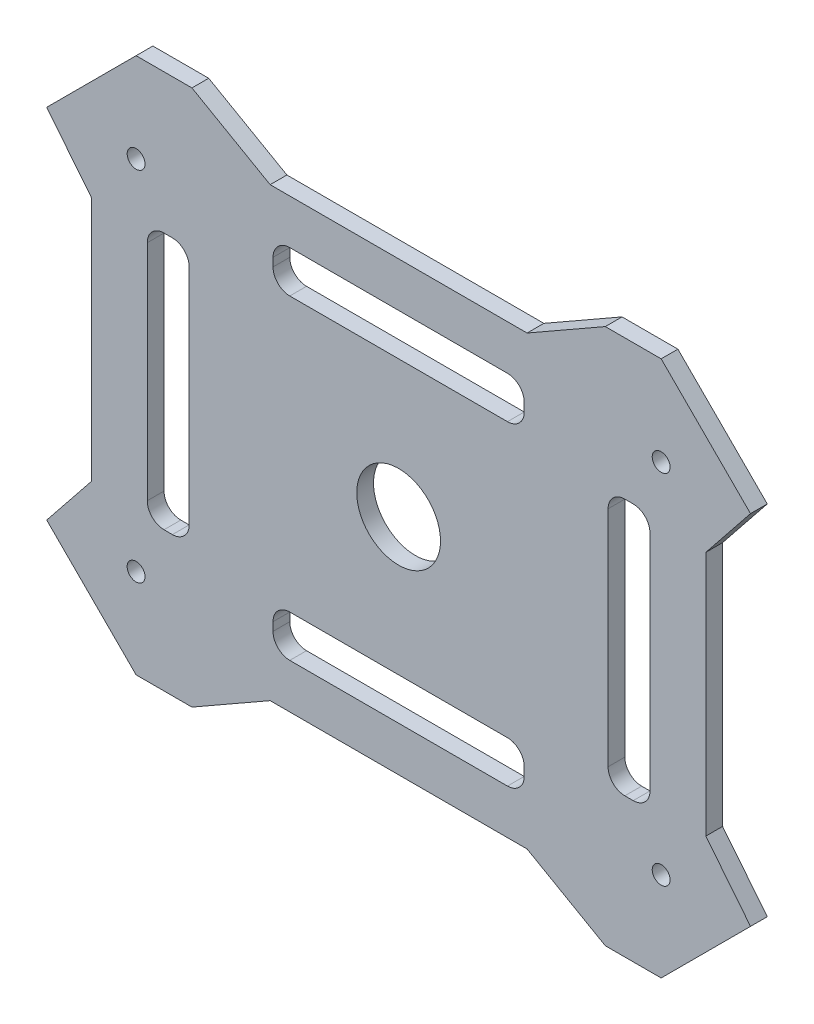
from build123d import *

# Parameters (mm, degrees)
SKETCH1_R           = 7.50000053
SKETCH1_R_2         = 1.6
BOSS_EXTRUDE1_DEPTH = 3


with BuildPart() as part:
    # Sketch1 → Boss-Extrude1 (new body)
    with BuildSketch(Plane.XY):
        Polygon((-135.687369551, 49.993029621), (-119.687369551, 65.993029621), (-109.687369551, 65.993029621), (-95.687369551, 57.993029621), (-49.687369551, 57.993029621), (-35.687369551, 65.993029621), (-25.687369551, 65.993029621), (-9.687369551, 49.993029621), (-17.687369551, 39.993029621), (-17.687369551, -4.006970379), (-9.687369551, -14.006970379), (-25.687369551, -30.006970379), (-35.687369551, -30.006970379), (-49.687369551, -22.006970379), (-95.687369551, -22.006970379), (-109.687369551, -30.006970379), (-119.687369551, -30.006970379), (-135.687369551, -14.006970379), (-127.687369551, -4.006970379), (-127.687369551, 39.993029621), align=None)
        with Locations((-72.687369551, 17.993029621)):
            Circle(SKETCH1_R, mode=Mode.SUBTRACT)
        with Locations((-119.687369551, 49.993029621)):
            Circle(SKETCH1_R_2, mode=Mode.SUBTRACT)
        with Locations((-25.687369551, 49.993029621)):
            Circle(SKETCH1_R_2, mode=Mode.SUBTRACT)
        with Locations((-25.687369551, -14.006970379)):
            Circle(SKETCH1_R_2, mode=Mode.SUBTRACT)
        with Locations((-119.687369551, -14.006970379)):
            Circle(SKETCH1_R_2, mode=Mode.SUBTRACT)
        with BuildLine():
            Line((-114.687369339, 40.993029833), (-113.187369339, 40.993029833))
            ThreePointArc((-113.187369339, 40.993029833), (-111.066048846, 40.114350115), (-110.187369127, 37.993029621))
            Line((-110.187369127, 37.993029621), (-110.187369127, -2.006970379))
            ThreePointArc((-110.187369127, -2.006970379), (-111.066048783, -4.128290723), (-113.187369127, -5.006970379))
            Line((-113.187369127, -5.006970379), (-114.687369551, -5.006970379))
            ThreePointArc((-114.687369551, -5.006970379), (-116.808689895, -4.128290723), (-117.687369551, -2.006970379))
            Line((-117.687369551, -2.006970379), (-117.687369551, 37.993029621))
            ThreePointArc((-117.687369551, 37.993029621), (-116.808689833, 40.114350115), (-114.687369339, 40.993029833))
        make_face(mode=Mode.SUBTRACT)
        with BuildLine():
            Line((-53.200533124, -14.006970379), (-92.174205979, -14.006970379))
            ThreePointArc((-92.174205979, -14.006970379), (-94.295526323, -13.128290723), (-95.174205979, -11.006970379))
            Line((-95.174205979, -11.006970379), (-95.174205979, -9.506970273))
            ThreePointArc((-95.174205979, -9.506970273), (-94.295526323, -7.385649929), (-92.174205979, -6.506970273))
            Line((-92.174205979, -6.506970273), (-53.200533124, -6.506970273))
            ThreePointArc((-53.200533124, -6.506970273), (-51.07921278, -7.385649929), (-50.200533124, -9.506970273))
            Line((-50.200533124, -9.506970273), (-50.200533124, -11.006970379))
            ThreePointArc((-50.200533124, -11.006970379), (-51.07921278, -13.128290723), (-53.200533124, -14.006970379))
        make_face(mode=Mode.SUBTRACT)
        with BuildLine():
            Line((-32.187369764, 40.993029833), (-30.687369764, 40.993029833))
            ThreePointArc((-30.687369764, 40.993029833), (-28.56604927, 40.114350115), (-27.687369551, 37.993029621))
            Line((-27.687369551, 37.993029621), (-27.687369551, -2.006970379))
            ThreePointArc((-27.687369551, -2.006970379), (-28.566049208, -4.128290723), (-30.687369551, -5.006970379))
            Line((-30.687369551, -5.006970379), (-32.187369976, -5.006970379))
            ThreePointArc((-32.187369976, -5.006970379), (-34.308690319, -4.128290723), (-35.187369976, -2.006970379))
            Line((-35.187369976, -2.006970379), (-35.187369976, 37.993029621))
            ThreePointArc((-35.187369976, 37.993029621), (-34.308690257, 40.114350115), (-32.187369764, 40.993029833))
        make_face(mode=Mode.SUBTRACT)
        with BuildLine():
            Line((-53.200533124, 42.493029515), (-92.174205979, 42.493029515))
            ThreePointArc((-92.174205979, 42.493029515), (-94.295526323, 43.371709171), (-95.174205979, 45.493029515))
            Line((-95.174205979, 45.493029515), (-95.174205979, 46.993029621))
            ThreePointArc((-95.174205979, 46.993029621), (-94.295526323, 49.114349965), (-92.174205979, 49.993029621))
            Line((-92.174205979, 49.993029621), (-53.200533124, 49.993029621))
            ThreePointArc((-53.200533124, 49.993029621), (-51.07921278, 49.114349965), (-50.200533124, 46.993029621))
            Line((-50.200533124, 46.993029621), (-50.200533124, 45.493029515))
            ThreePointArc((-50.200533124, 45.493029515), (-51.07921278, 43.371709171), (-53.200533124, 42.493029515))
        make_face(mode=Mode.SUBTRACT)
    extrude(amount=BOSS_EXTRUDE1_DEPTH)


solid = part.part
